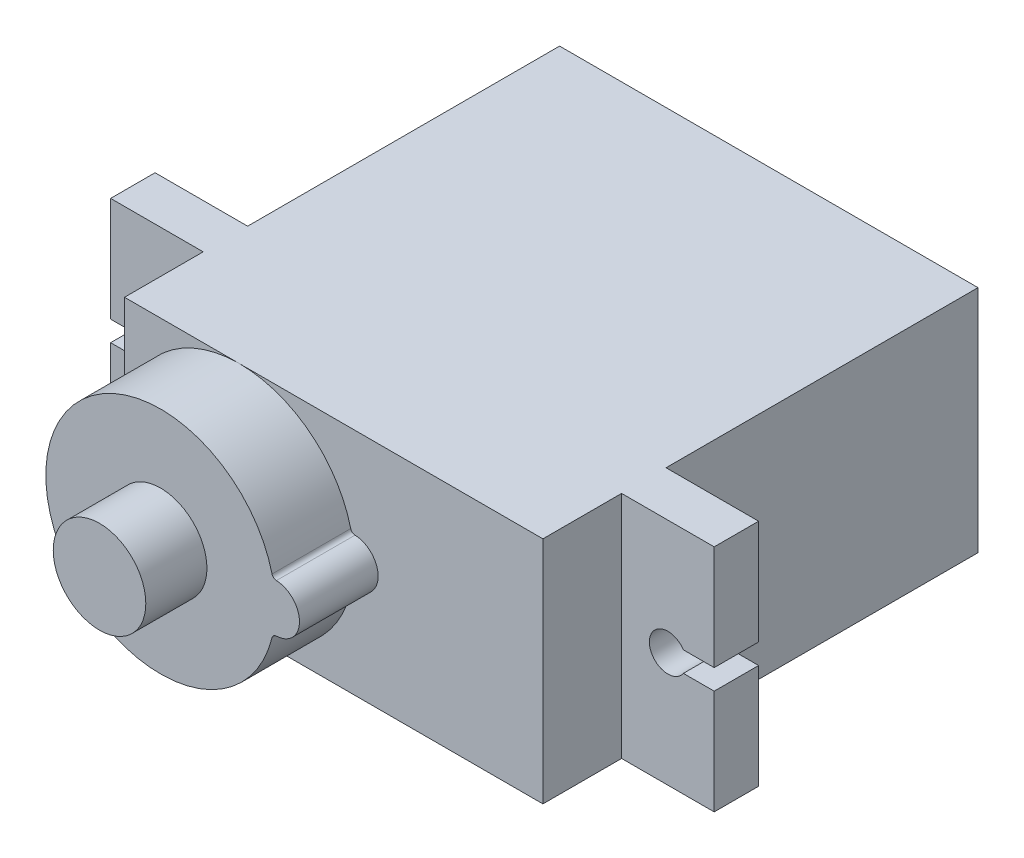
from build123d import *

# Parameters (mm, degrees)
SKETCH1_W           = 22.6
SKETCH1_H           = 12.4
BOSS_EXTRUDE1_DEPTH = 23.5
SKETCH3_W           = 5
SKETCH3_H           = 2.4
BOSS_EXTRUDE2_DEPTH = 12.4
CUT_EXTRUDE1_DEPTH  = 26.974843599
BOSS_EXTRUDE3_DEPTH = 4.25
SKETCH6_R           = 2.5
BOSS_EXTRUDE4_DEPTH = 3.3


with BuildPart() as part:
    # Sketch1 → Boss-Extrude1 (new body)
    with BuildSketch(Plane.XY):
        Rectangle(SKETCH1_W, SKETCH1_H)
    extrude(amount=BOSS_EXTRUDE1_DEPTH)

    # Sketch3 → Boss-Extrude2 (add)
    with BuildSketch(Plane.XZ.offset(6.2)):
        with Locations((13.8, 18.05)):
            Rectangle(SKETCH3_W, SKETCH3_H)
        with Locations((-13.8, 18.05)):
            Rectangle(SKETCH3_W, SKETCH3_H)
    extrude(amount=-BOSS_EXTRUDE2_DEPTH)

    # Sketch4 → Cut-Extrude1 (cut, through all)
    with BuildSketch(Plane.XY.offset(19.25)):
        with BuildLine():
            Line((16.3, 0.55), (16.3, -0.55))
            Line((16.3, -0.55), (14.635164654, -0.55))
            ThreePointArc((14.635164654, -0.55), (12.8, 0), (14.635164654, 0.55))
            Line((14.635164654, 0.55), (16.3, 0.55))
        make_face()
        with BuildLine():
            Line((-16.3, 0.55), (-14.635164654, 0.55))
            ThreePointArc((-14.635164654, 0.55), (-12.8, 0), (-14.635164654, -0.55))
            Line((-14.635164654, -0.55), (-16.3, -0.55))
            Line((-16.3, -0.55), (-16.3, 0.55))
        make_face()
    extrude(amount=-CUT_EXTRUDE1_DEPTH, mode=Mode.SUBTRACT)

    # Sketch5 → Boss-Extrude3 (add)
    with BuildSketch(Plane.XY.offset(23.5)):
        with BuildLine():
            ThreePointArc((0.918604651, 1.488757218), (-11.3, 0), (0.918604651, -1.488757218))
            ThreePointArc((0.918604651, -1.488757218), (1.003329596, -1.355013632), (1.151404787, -1.298983275))
            ThreePointArc((1.151404787, -1.298983275), (2.4, 0), (1.151404787, 1.298983275))
            ThreePointArc((1.151404787, 1.298983275), (1.003329596, 1.355013632), (0.918604651, 1.488757218))
        make_face()
    extrude(amount=BOSS_EXTRUDE3_DEPTH)

    # Sketch6 → Boss-Extrude4 (add)
    with BuildSketch(Plane.XY.offset(27.75)):
        with Locations(Location((-5.1, 0, 0), (0, 0, 180))):
            Circle(SKETCH6_R)
    extrude(amount=BOSS_EXTRUDE4_DEPTH)


solid = part.part
